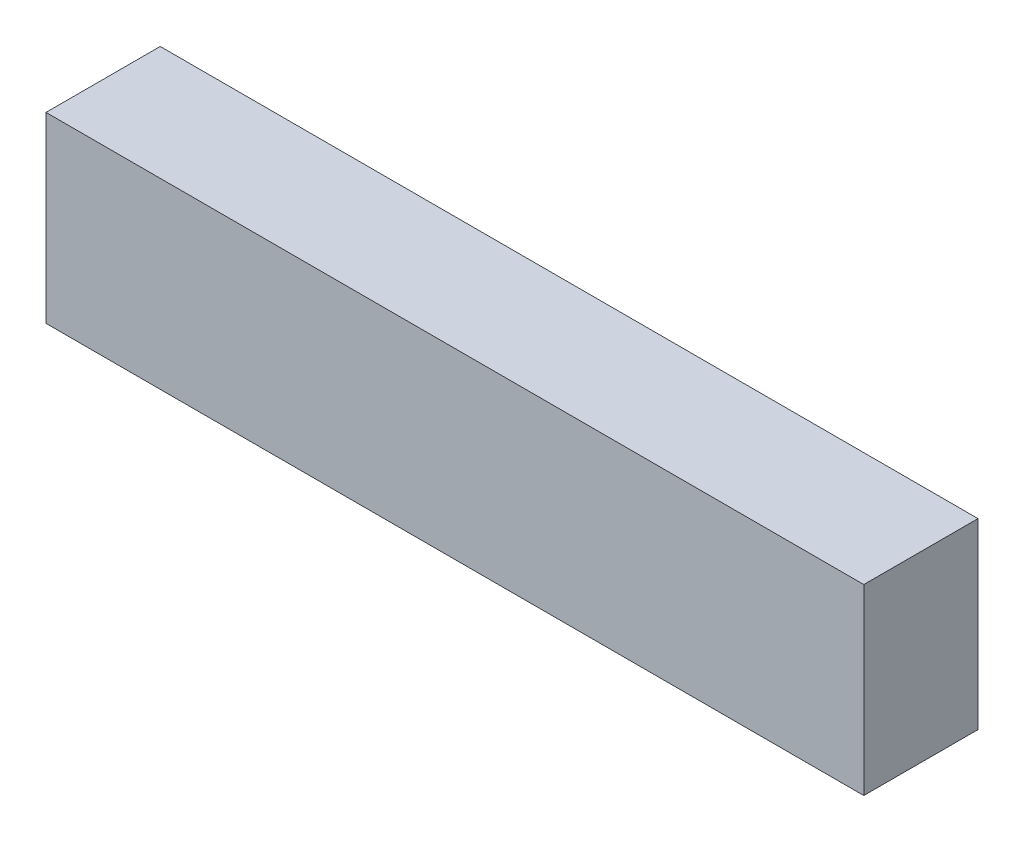
from build123d import *

# Parameters (mm, degrees)
ESQUISSE1_W        = 179
ESQUISSE1_H        = 40
BOSS_EXTRU_1_DEPTH = 25


with BuildPart() as part:
    # Esquisse1 → Boss.-Extru.1 (new body)
    with BuildSketch(Plane.XY):
        with Locations((89.5, 20)):
            Rectangle(ESQUISSE1_W, ESQUISSE1_H)
    extrude(amount=BOSS_EXTRU_1_DEPTH)


solid = part.part
